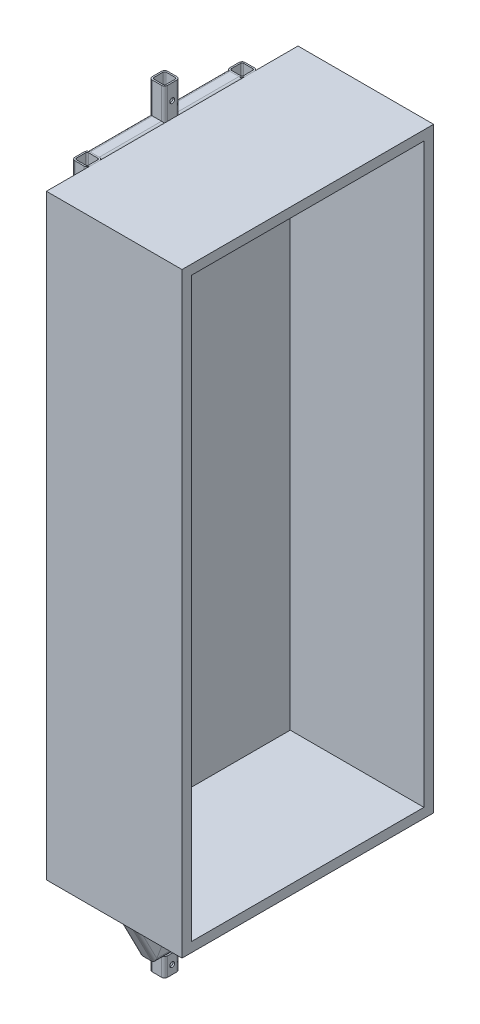
from build123d import *

# Parameters (mm, degrees)
SKETCH136_R                          = 10.65
SKETCH136_R_2                        = 8.35
PIPE_21_3_X_2_3_1_DEPTH              = 203.2
SKETCH136_ON_SEGMENT_2_R             = 10.65
SKETCH136_ON_SEGMENT_2_R_2           = 8.35
PIPE_21_3_X_2_3_1_2_DEPTH            = 254
SQUARE_TUBE_20_X_20_X_2_7_DEPTH      = 772
SQUARE_TUBE_20_X_20_X_2_7_DEPTH_BACK = 10
SQUARE_TUBE_20_X_20_X_2_7_2_DEPTH    = 782
SQUARE_TUBE_20_X_20_X_2_7_3_DEPTH    = 205.2
SQUARE_TUBE_20_X_20_X_2_7_4_DEPTH    = 205.2
SQUARE_TUBE_20_X_20_X_2_11_DEPTH     = 195.781060743
SQUARE_TUBE_20_X_20_X_2_11_2_DEPTH   = 52.285580038
SQUARE_TUBE_20_X_20_X_2_11_3_DEPTH   = 195.819218929
SQUARE_TUBE_20_X_20_X_2_11_4_DEPTH   = 35.476475346
SQUARE_TUBE_20_X_20_X_2_11_5_DEPTH   = 50.8
SKETCH148_R                          = 8.35
CUT_EXTRUDE3_DEPTH                   = 635.240007535
BOSS_EXTRUDE2_START                  = -20
BOSS_EXTRUDE2_DEPTH                  = 177.8
SKETCH156_W                          = 756.6
SKETCH156_H                          = 304.48
CUT_EXTRUDE6_DEPTH                   = 175.26
SKETCH147_R                          = 3.175
CUT_EXTRUDE8_DEPTH                   = 630.64196831


with BuildPart() as part:
    # Sketch136 → Pipe 21.3 X 2.3(1) (new body)
    with BuildSketch(Plane(origin=(0, 0, 101.6), x_dir=(1, 0, 0), z_dir=(0, 0, -1))):
        Circle(SKETCH136_R)
        Circle(SKETCH136_R_2, mode=Mode.SUBTRACT)
    extrude(amount=PIPE_21_3_X_2_3_1_DEPTH)


with BuildPart() as body_2:
    # Sketch136 on segment 2 (carried to segment 2) → Pipe 21.3 X 2.3_1 2 (new body)
    with BuildSketch(Plane(origin=(0, 254, 127), x_dir=(1, 0, 0), z_dir=(0, 0, -1))):
        Circle(SKETCH136_ON_SEGMENT_2_R)
        Circle(SKETCH136_ON_SEGMENT_2_R_2, mode=Mode.SUBTRACT)
    extrude(amount=PIPE_21_3_X_2_3_1_2_DEPTH)


with BuildPart() as body_3:
    # Sketch141 → Square tube 20 X 20 X 2(7) (new, two sides: drawn at the far end of the back side and taken through both)
    with BuildSketch(Plane(origin=(0, -381, -101.6), x_dir=(1, 0, 0), z_dir=(0, 1, 0)).offset(-SQUARE_TUBE_20_X_20_X_2_7_DEPTH_BACK)):
        with BuildLine():
            Line((-6, -10), (6, -10))
            ThreePointArc((6, -10), (8.828427125, -8.828427125), (10, -6))
            Line((10, -6), (10, 6))
            ThreePointArc((10, 6), (8.828427125, 8.828427125), (6, 10))
            Line((6, 10), (-6, 10))
            ThreePointArc((-6, 10), (-8.828427125, 8.828427125), (-10, 6))
            Line((-10, 6), (-10, -6))
            ThreePointArc((-10, -6), (-8.828427125, -8.828427125), (-6, -10))
        make_face()
        with BuildLine():
            Line((-6, -8), (6, -8))
            ThreePointArc((6, -8), (7.414213562, -7.414213562), (8, -6))
            Line((8, -6), (8, 6))
            ThreePointArc((8, 6), (7.414213562, 7.414213562), (6, 8))
            Line((6, 8), (-6, 8))
            ThreePointArc((-6, 8), (-7.414213562, 7.414213562), (-8, 6))
            Line((-8, 6), (-8, -6))
            ThreePointArc((-8, -6), (-7.414213562, -7.414213562), (-6, -8))
        make_face(mode=Mode.SUBTRACT)
    extrude(amount=SQUARE_TUBE_20_X_20_X_2_7_DEPTH + SQUARE_TUBE_20_X_20_X_2_7_DEPTH_BACK)


with BuildPart() as body_4:
    # Sketch141 on segment 2 (carried to segment 2) → Square tube 20 X 20 X 2_7 2 (new body)
    with BuildSketch(Plane(origin=(0, -391, 101.6), x_dir=(1, 0, 0), z_dir=(0, 1, 0))):
        with BuildLine():
            Line((-6, -10), (6, -10))
            ThreePointArc((6, -10), (8.828427125, -8.828427125), (10, -6))
            Line((10, -6), (10, 6))
            ThreePointArc((10, 6), (8.828427125, 8.828427125), (6, 10))
            Line((6, 10), (-6, 10))
            ThreePointArc((-6, 10), (-8.828427125, 8.828427125), (-10, 6))
            Line((-10, 6), (-10, -6))
            ThreePointArc((-10, -6), (-8.828427125, -8.828427125), (-6, -10))
        make_face()
        with BuildLine():
            Line((-6, -8), (6, -8))
            ThreePointArc((6, -8), (7.414213562, -7.414213562), (8, -6))
            Line((8, -6), (8, 6))
            ThreePointArc((8, 6), (7.414213562, 7.414213562), (6, 8))
            Line((6, 8), (-6, 8))
            ThreePointArc((-6, 8), (-7.414213562, 7.414213562), (-8, 6))
            Line((-8, 6), (-8, -6))
            ThreePointArc((-8, -6), (-7.414213562, -7.414213562), (-6, -8))
        make_face(mode=Mode.SUBTRACT)
    extrude(amount=SQUARE_TUBE_20_X_20_X_2_7_2_DEPTH)


with BuildPart() as body_5:
    # Sketch141 on segment 3 (carried to segment 3) → Square tube 20 X 20 X 2_7 3 (new body)
    with BuildSketch(Plane(origin=(0, -381, 102.6), x_dir=(1, 0, 0), z_dir=(0, 0, -1))):
        with BuildLine():
            Line((-6, -10), (6, -10))
            ThreePointArc((6, -10), (8.828427125, -8.828427125), (10, -6))
            Line((10, -6), (10, 6))
            ThreePointArc((10, 6), (8.828427125, 8.828427125), (6, 10))
            Line((6, 10), (-6, 10))
            ThreePointArc((-6, 10), (-8.828427125, 8.828427125), (-10, 6))
            Line((-10, 6), (-10, -6))
            ThreePointArc((-10, -6), (-8.828427125, -8.828427125), (-6, -10))
        make_face()
        with BuildLine():
            Line((-6, -8), (6, -8))
            ThreePointArc((6, -8), (7.414213562, -7.414213562), (8, -6))
            Line((8, -6), (8, 6))
            ThreePointArc((8, 6), (7.414213562, 7.414213562), (6, 8))
            Line((6, 8), (-6, 8))
            ThreePointArc((-6, 8), (-7.414213562, 7.414213562), (-8, 6))
            Line((-8, 6), (-8, -6))
            ThreePointArc((-8, -6), (-7.414213562, -7.414213562), (-6, -8))
        make_face(mode=Mode.SUBTRACT)
    extrude(amount=SQUARE_TUBE_20_X_20_X_2_7_3_DEPTH)

    # Square tube 20 X 20 X 2_7 3 end butt 1
    split(bisect_by=Plane(origin=(0, -381, 91.6), x_dir=(0, 1, 0), z_dir=(0, 0, -1)), keep=Keep.TOP)

    # Square tube 20 X 20 X 2_7 3 end butt 2
    split(bisect_by=Plane(origin=(0, -381, -91.6), x_dir=(0, -1, 0), z_dir=(0, 0, 1)), keep=Keep.TOP)


with BuildPart() as body_6:
    # Sketch141 on segment 4 (carried to segment 4) → Square tube 20 X 20 X 2_7 4 (new body)
    with BuildSketch(Plane(origin=(0, 381, 102.6), x_dir=(1, 0, 0), z_dir=(0, 0, -1))):
        with BuildLine():
            Line((-6, -10), (6, -10))
            ThreePointArc((6, -10), (8.828427125, -8.828427125), (10, -6))
            Line((10, -6), (10, 6))
            ThreePointArc((10, 6), (8.828427125, 8.828427125), (6, 10))
            Line((6, 10), (-6, 10))
            ThreePointArc((-6, 10), (-8.828427125, 8.828427125), (-10, 6))
            Line((-10, 6), (-10, -6))
            ThreePointArc((-10, -6), (-8.828427125, -8.828427125), (-6, -10))
        make_face()
        with BuildLine():
            Line((-6, -8), (6, -8))
            ThreePointArc((6, -8), (7.414213562, -7.414213562), (8, -6))
            Line((8, -6), (8, 6))
            ThreePointArc((8, 6), (7.414213562, 7.414213562), (6, 8))
            Line((6, 8), (-6, 8))
            ThreePointArc((-6, 8), (-7.414213562, 7.414213562), (-8, 6))
            Line((-8, 6), (-8, -6))
            ThreePointArc((-8, -6), (-7.414213562, -7.414213562), (-6, -8))
        make_face(mode=Mode.SUBTRACT)
    extrude(amount=SQUARE_TUBE_20_X_20_X_2_7_4_DEPTH)

    # Square tube 20 X 20 X 2_7 4 end butt 1
    split(bisect_by=Plane(origin=(0, 381, 91.6), x_dir=(0, 1, 0), z_dir=(0, 0, -1)), keep=Keep.TOP)

    # Square tube 20 X 20 X 2_7 4 end butt 2
    split(bisect_by=Plane(origin=(0, 381, -91.6), x_dir=(0, -1, 0), z_dir=(0, 0, 1)), keep=Keep.TOP)


with BuildPart() as body_7:
    # Sketch146 → Square tube 20 X 20 X 2(11) (new body)
    with BuildSketch(Plane(origin=(0, -381, 101.6), x_dir=(1, 0, 0), z_dir=(0, -0.8895363233695567, -0.45686445408476645))):
        with BuildLine():
            Line((-6, -10), (6, -10))
            ThreePointArc((6, -10), (8.828427125, -8.828427125), (10, -6))
            Line((10, -6), (10, 6))
            ThreePointArc((10, 6), (8.828427125, 8.828427125), (6, 10))
            Line((6, 10), (-6, 10))
            ThreePointArc((-6, 10), (-8.828427125, 8.828427125), (-10, 6))
            Line((-10, 6), (-10, -6))
            ThreePointArc((-10, -6), (-8.828427125, -8.828427125), (-6, -10))
        make_face()
        with BuildLine():
            Line((-6, -8), (6, -8))
            ThreePointArc((6, -8), (7.414213562, -7.414213562), (8, -6))
            Line((8, -6), (8, 6))
            ThreePointArc((8, 6), (7.414213562, 7.414213562), (6, 8))
            Line((6, 8), (-6, 8))
            ThreePointArc((-6, 8), (-7.414213562, 7.414213562), (-8, 6))
            Line((-8, 6), (-8, -6))
            ThreePointArc((-8, -6), (-7.414213562, -7.414213562), (-6, -8))
        make_face(mode=Mode.SUBTRACT)
    extrude(amount=SQUARE_TUBE_20_X_20_X_2_11_DEPTH)

    # Square tube 20 X 20 X 2(11) mitre 1
    split(bisect_by=Plane(origin=(0, -546.583732083, 16.556456104), x_dir=(-1, 0, 0), z_dir=(0, 0.521121649, 0.853482412)), keep=Keep.TOP)


with BuildPart() as body_8:
    # Sketch146 on segment 2 (carried to segment 2) → Square tube 20 X 20 X 2_11 2 (new body)
    with BuildSketch(Plane(origin=(0, -546.583732083, 26.191400345), x_dir=(1, 0, 0), z_dir=(0, 0, -1))):
        with BuildLine():
            Line((-6, -10), (6, -10))
            ThreePointArc((6, -10), (8.828427125, -8.828427125), (10, -6))
            Line((10, -6), (10, 6))
            ThreePointArc((10, 6), (8.828427125, 8.828427125), (6, 10))
            Line((6, 10), (-6, 10))
            ThreePointArc((-6, 10), (-8.828427125, 8.828427125), (-10, 6))
            Line((-10, 6), (-10, -6))
            ThreePointArc((-10, -6), (-8.828427125, -8.828427125), (-6, -10))
        make_face()
        with BuildLine():
            Line((-6, -8), (6, -8))
            ThreePointArc((6, -8), (7.414213562, -7.414213562), (8, -6))
            Line((8, -6), (8, 6))
            ThreePointArc((8, 6), (7.414213562, 7.414213562), (6, 8))
            Line((6, 8), (-6, 8))
            ThreePointArc((-6, 8), (-7.414213562, 7.414213562), (-8, 6))
            Line((-8, 6), (-8, -6))
            ThreePointArc((-8, -6), (-7.414213562, -7.414213562), (-6, -8))
        make_face(mode=Mode.SUBTRACT)
    extrude(amount=SQUARE_TUBE_20_X_20_X_2_11_2_DEPTH)

    # Square tube 20 X 20 X 2_11 2 mitre 1
    split(bisect_by=Plane(origin=(0, -546.583732083, 16.556456104), x_dir=(1, 0, 0), z_dir=(0, -0.521121649, -0.853482412)), keep=Keep.TOP)

    # Square tube 20 X 20 X 2_11 2 mitre 2
    split(bisect_by=Plane(origin=(0, -546.583732083, -16.463543896), x_dir=(1, 0, 0), z_dir=(0, -0.520932206, 0.853598053)), keep=Keep.TOP)


with BuildPart() as body_9:
    # Sketch146 on segment 3 (carried to segment 3) → Square tube 20 X 20 X 2_11 3 (new body)
    with BuildSketch(Plane(origin=(0, -555.148578492, -12.059846376), x_dir=(1, 0, 0), z_dir=(0, 0.889333434, -0.457259273))):
        with BuildLine():
            Line((-6, -10), (6, -10))
            ThreePointArc((6, -10), (8.828427125, -8.828427125), (10, -6))
            Line((10, -6), (10, 6))
            ThreePointArc((10, 6), (8.828427125, 8.828427125), (6, 10))
            Line((6, 10), (-6, 10))
            ThreePointArc((-6, 10), (-8.828427125, 8.828427125), (-10, 6))
            Line((-10, 6), (-10, -6))
            ThreePointArc((-10, -6), (-8.828427125, -8.828427125), (-6, -10))
        make_face()
        with BuildLine():
            Line((-6, -8), (6, -8))
            ThreePointArc((6, -8), (7.414213562, -7.414213562), (8, -6))
            Line((8, -6), (8, 6))
            ThreePointArc((8, 6), (7.414213562, 7.414213562), (6, 8))
            Line((6, 8), (-6, 8))
            ThreePointArc((-6, 8), (-7.414213562, 7.414213562), (-8, 6))
            Line((-8, 6), (-8, -6))
            ThreePointArc((-8, -6), (-7.414213562, -7.414213562), (-6, -8))
        make_face(mode=Mode.SUBTRACT)
    extrude(amount=SQUARE_TUBE_20_X_20_X_2_11_3_DEPTH)

    # Square tube 20 X 20 X 2_11 3 mitre 1
    split(bisect_by=Plane(origin=(0, -546.583732083, -16.463543896), x_dir=(-1, 0, 0), z_dir=(0, 0.520932206, -0.853598053)), keep=Keep.TOP)


with BuildPart() as body_10:
    # Sketch146 on segment 4 (carried to segment 4) → Square tube 20 X 20 X 2_11 4 (new body)
    with BuildSketch(Plane(origin=(0, -581.060207429, 0), x_dir=(1, 0, 0), z_dir=(0, 1, 0))):
        with BuildLine():
            Line((-6, -10), (6, -10))
            ThreePointArc((6, -10), (8.828427125, -8.828427125), (10, -6))
            Line((10, -6), (10, 6))
            ThreePointArc((10, 6), (8.828427125, 8.828427125), (6, 10))
            Line((6, 10), (-6, 10))
            ThreePointArc((-6, 10), (-8.828427125, 8.828427125), (-10, 6))
            Line((-10, 6), (-10, -6))
            ThreePointArc((-10, -6), (-8.828427125, -8.828427125), (-6, -10))
        make_face()
        with BuildLine():
            Line((-6, -8), (6, -8))
            ThreePointArc((6, -8), (7.414213562, -7.414213562), (8, -6))
            Line((8, -6), (8, 6))
            ThreePointArc((8, 6), (7.414213562, 7.414213562), (6, 8))
            Line((6, 8), (-6, 8))
            ThreePointArc((-6, 8), (-7.414213562, 7.414213562), (-8, 6))
            Line((-8, 6), (-8, -6))
            ThreePointArc((-8, -6), (-7.414213562, -7.414213562), (-6, -8))
        make_face(mode=Mode.SUBTRACT)
    extrude(amount=SQUARE_TUBE_20_X_20_X_2_11_4_DEPTH)

    # Square tube 20 X 20 X 2_11 4 mitre 1
    split(bisect_by=Plane.XZ.offset(556.583732083), keep=Keep.TOP)


with BuildPart() as body_11:
    # Sketch146 on segment 5 (carried to segment 5) → Square tube 20 X 20 X 2_11 5 (new body)
    with BuildSketch(Plane(origin=(0, 381, 0), x_dir=(1, 0, 0), z_dir=(0, 1, 0))):
        with BuildLine():
            Line((-6, -10), (6, -10))
            ThreePointArc((6, -10), (8.828427125, -8.828427125), (10, -6))
            Line((10, -6), (10, 6))
            ThreePointArc((10, 6), (8.828427125, 8.828427125), (6, 10))
            Line((6, 10), (-6, 10))
            ThreePointArc((-6, 10), (-8.828427125, 8.828427125), (-10, 6))
            Line((-10, 6), (-10, -6))
            ThreePointArc((-10, -6), (-8.828427125, -8.828427125), (-6, -10))
        make_face()
        with BuildLine():
            Line((-6, -8), (6, -8))
            ThreePointArc((6, -8), (7.414213562, -7.414213562), (8, -6))
            Line((8, -6), (8, 6))
            ThreePointArc((8, 6), (7.414213562, 7.414213562), (6, 8))
            Line((6, 8), (-6, 8))
            ThreePointArc((-6, 8), (-7.414213562, 7.414213562), (-8, 6))
            Line((-8, 6), (-8, -6))
            ThreePointArc((-8, -6), (-7.414213562, -7.414213562), (-6, -8))
        make_face(mode=Mode.SUBTRACT)
    extrude(amount=SQUARE_TUBE_20_X_20_X_2_11_5_DEPTH)


with BuildPart() as cut_extrude3_tool:
    # Sketch148 → Cut-Extrude3 (new, through all)
    with BuildSketch(Plane(origin=(0, 0, -127), x_dir=(-1, 0, 0), z_dir=(0, 0, -1))):
        with Locations(Location((0, 254, 0), (0, 0, 44.064044211))):
            Circle(SKETCH148_R)
    extrude(amount=-CUT_EXTRUDE3_DEPTH)


with BuildPart() as body_3_1:
    add(body_3.part)

    # Cut-Extrude3: cut by cut_extrude3_tool
    add(cut_extrude3_tool.part, mode=Mode.SUBTRACT)


with BuildPart() as body_4_1:
    add(body_4.part)

    # Cut-Extrude3: cut by cut_extrude3_tool
    add(cut_extrude3_tool.part, mode=Mode.SUBTRACT)


with BuildPart() as body_12:
    # Sketch154 → Boss-Extrude2 (new body)
    with BuildSketch(Plane(origin=(-10, 0, 0), x_dir=(0, -1, 0), z_dir=(-1, 0, 0)).offset(BOSS_EXTRUDE2_START)):
        Polygon((-391, 111.6), (-391, -111.6), (-391, -164.94), (391, -164.94), (391, -111.6), (391, 111.6), (391, 164.94), (-391, 164.94), align=None)
    extrude(amount=-BOSS_EXTRUDE2_DEPTH)

    # Sketch156 → Cut-Extrude6 (cut)
    with BuildSketch(Plane.YZ.offset(187.8)):
        Rectangle(SKETCH156_W, SKETCH156_H)
    extrude(amount=-CUT_EXTRUDE6_DEPTH, mode=Mode.SUBTRACT)


with BuildPart() as cut_extrude8_tool:
    # Sketch147 → Cut-Extrude8 (new, through all)
    with BuildSketch(Plane.YZ.offset(10)):
        with Locations(Location((-569.620388349, 0, 0), (0, 0, 270))):
            Circle(SKETCH147_R)
        with Locations(Location((411.4, 0, 0), (0, 0, 270))):
            Circle(SKETCH147_R)
    extrude(amount=-CUT_EXTRUDE8_DEPTH)


with BuildPart() as body_10_1:
    add(body_10.part)

    # Cut-Extrude8: cut by cut_extrude8_tool
    add(cut_extrude8_tool.part, mode=Mode.SUBTRACT)


with BuildPart() as body_11_1:
    add(body_11.part)

    # Cut-Extrude8: cut by cut_extrude8_tool
    add(cut_extrude8_tool.part, mode=Mode.SUBTRACT)


solid = Compound([part.part, body_2.part, body_5.part, body_6.part, body_7.part, body_8.part, body_9.part, body_3_1.part, body_4_1.part, body_12.part, body_10_1.part, body_11_1.part])
